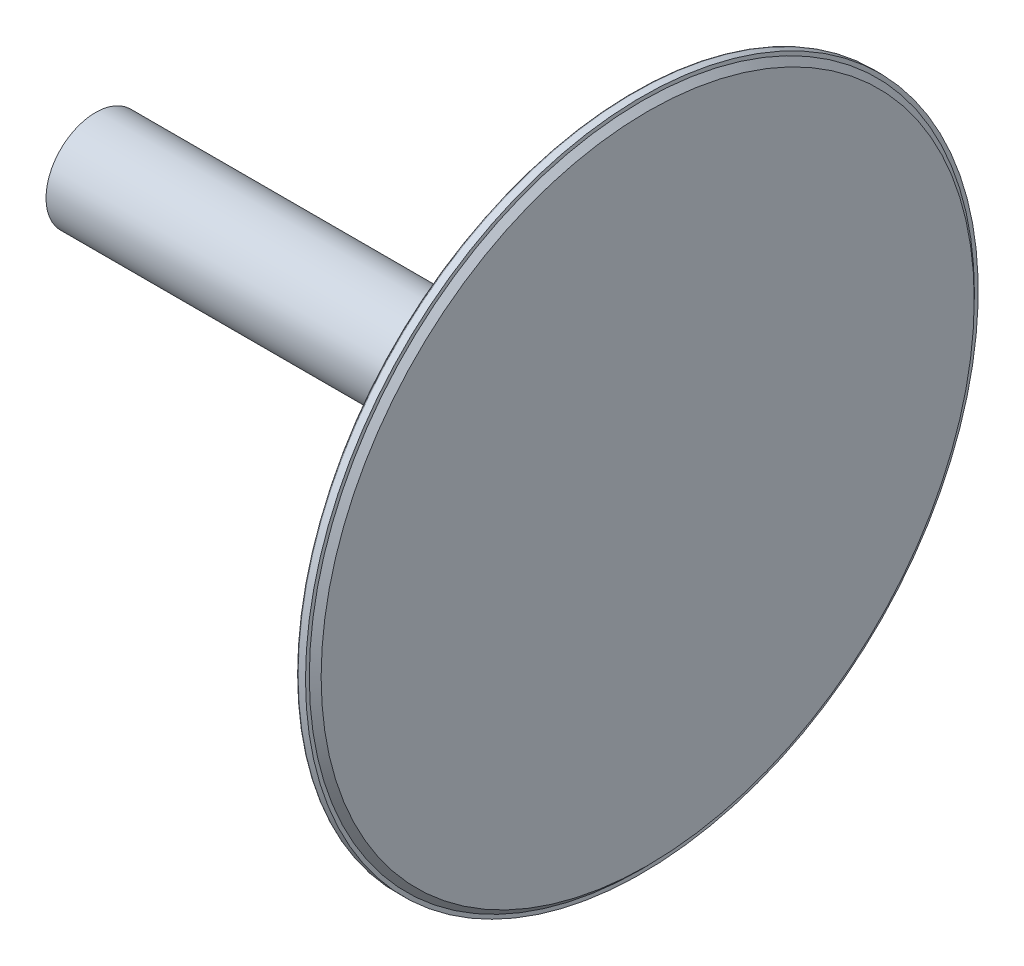
from build123d import *

# Parameters (mm, degrees)
SKETCH4_R           = 8.5
BOSS_EXTRUDE2_DEPTH = 84.8
CHAMFER2_SIZE       = 0.272977676
CHAMFER2_SIZE2      = 0.75
FILLET1_R           = 0.25


with BuildPart() as part:
    # Sketch1 → Revolve1 (revolve)
    with BuildSketch(Plane(origin=(0, 0, 0), x_dir=(-1, 0, 0), z_dir=(0, 0, -1)), mode=Mode.PRIVATE) as revolve1_sk:
        Polygon((-7.2, 56.065405665), (-7.2, 0), (2.8, 0), (2.8, 10), (-1.2, 10), (-1.2, 9), (-2.5, 9), (-2.5, 10), (-3.7, 10), (-3.7, 56.25), (-4.7, 56.25), (-4.7, 57.75), (-6.2, 57.75), (-6.2, 57.1), align=None)
    revolve(revolve1_sk.sketch.rotate(Axis((7.200025, 0, 0), (-1, 0, 0)), 270), axis=Axis((7.200025, 0, 0), (-1, 0, 0)))

    # Sketch4 → Boss-Extrude2 (add)
    with BuildSketch(Plane.ZY.offset(2.8)):
        Circle(SKETCH4_R)
    extrude(amount=BOSS_EXTRUDE2_DEPTH)

    # Chamfer2
    chamfer2_edges = [part.edges().sort_by_distance(p)[0] for p in [
        (-2.8, 0, -10),
    ]]
    chamfer2_side = [part.faces().sort_by_distance(p)[0] for p in [
        (-2.8, 0, -9.717157288),
    ]]
    chamfer(chamfer2_edges, length=CHAMFER2_SIZE, length2=CHAMFER2_SIZE2, reference=chamfer2_side[0])

    # Fillet1
    fillet1_edges = [part.edges().sort_by_distance(p)[0] for p in [
        (4.7, 0, -57.75),
    ]]
    fillet(fillet1_edges, radius=FILLET1_R)


solid = part.part
